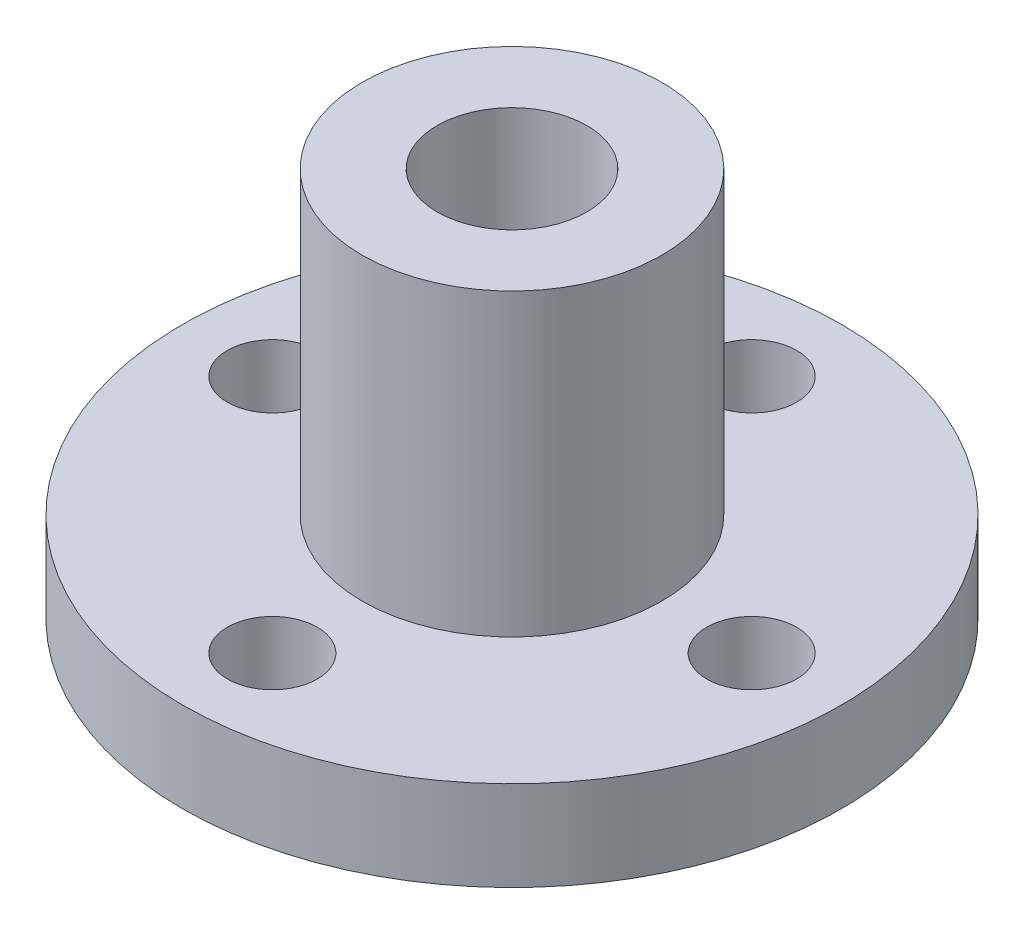
from build123d import *

# Parameters (mm, degrees)
SKETCH_1_R          = 11
EXTRUDE_1_DEPTH     = 3
SKETCH_2_R          = 5
EXTRUDE_2_DEPTH     = 10
SKETCH_3_R          = 2.5
CUT_EXTRUDE_1_DEPTH = 13
SKETCH_4_R          = 1.5
CUT_EXTRUDE_2_DEPTH = 3


with BuildPart() as part:
    # 草图1 → 凸台-拉伸1 (new body)
    with BuildSketch(Plane(origin=(0, 0, 0), x_dir=(1, 0, 0), z_dir=(0, 1, 0))):
        with Locations(Location((0, 0, 0), (0, 0, 270))):
            Circle(SKETCH_1_R)
    extrude(amount=EXTRUDE_1_DEPTH)

    # 草图2 → 凸台-拉伸2 (add)
    with BuildSketch(Plane(origin=(0, 3, 0), x_dir=(1, 0, 0), z_dir=(0, 1, 0))):
        with Locations(Location((0, 0, 0), (0, 0, 270))):
            Circle(SKETCH_2_R)
    extrude(amount=EXTRUDE_2_DEPTH)

    # 草图3 → 切除-拉伸1 (cut)
    with BuildSketch(Plane(origin=(0, 13, 0), x_dir=(1, 0, 0), z_dir=(0, 1, 0))):
        with Locations(Location((0, 0, 0), (0, 0, 270))):
            Circle(SKETCH_3_R)
    extrude(amount=-CUT_EXTRUDE_1_DEPTH, mode=Mode.SUBTRACT)

    # 草图4 → 切除-拉伸2 (cut)
    with BuildSketch(Plane.XZ):
        with Locations(Location((0, 8, 0), (0, 0, 270))):
            Circle(SKETCH_4_R)
        with Locations(Location((8, 0, 0), (0, 0, 270))):
            Circle(SKETCH_4_R)
        with Locations(Location((0, -8, 0), (0, 0, 270))):
            Circle(SKETCH_4_R)
        with Locations(Location((-8, 0, 0), (0, 0, 270))):
            Circle(SKETCH_4_R)
    extrude(amount=-CUT_EXTRUDE_2_DEPTH, mode=Mode.SUBTRACT)


solid = part.part
